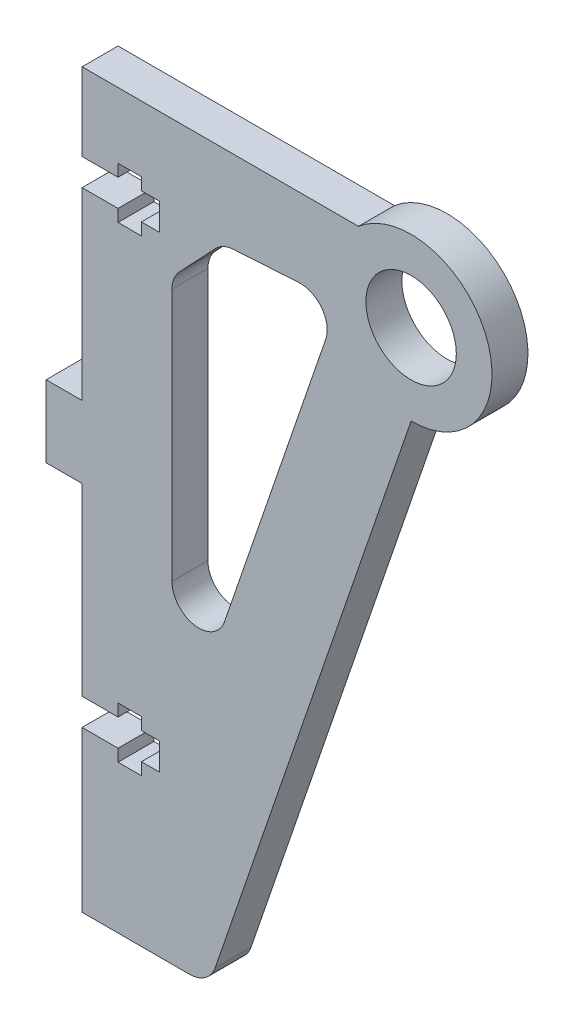
from build123d import *

# Parameters (mm, degrees)
SKETCH_1_R          = 5.03
EXTRUDE_1_DEPTH     = 4
CUT_EXTRUDE_1_DEPTH = 4
SKETCH_4_W          = 4
SKETCH_4_H          = 8
EXTRUDE_2_DEPTH     = 4


with BuildPart() as part:
    # 草图1 → 凸台-拉伸1 (new body)
    with BuildSketch(Plane.XY):
        with BuildLine():
            Line((-59.1, 38.97114317), (-59.1, 2.206540881))
            Line((-59.1, 2.206540881), (-59.1, -35.646026533))
            Line((-59.1, -35.646026533), (-47.142774211, -35.646026533))
            ThreePointArc((-47.142774211, -35.646026533), (-45.399104316, -35.087258865), (-44.304971996, -33.619103399))
            Line((-44.304971996, -33.619103399), (-22.5, 29.97114317))
            ThreePointArc((-22.5, 29.97114317), (-14.057833007, 42.090408542), (-28.351857593, 45.808961734))
            Line((-28.351857593, 45.808961734), (-56.281374572, 45.808961734))
            Line((-56.281374572, 45.808961734), (-59.1, 45.808961734))
            Line((-59.1, 45.808961734), (-59.1, 42.814449543))
            Line((-59.1, 42.814449543), (-59.1, 38.97114317))
        make_face()
        with BuildLine():
            ThreePointArc((-35.014022641, 37.07877749), (-34.09949662, 36.993301041), (-33.253696548, 36.635130268))
            ThreePointArc((-33.253696548, 36.635130268), (-32.007498532, 35.093487817), (-31.994845854, 33.111188432))
            Line((-31.994845854, 33.111188432), (-43.262197785, 0.251999821))
            ThreePointArc((-43.262197785, 0.251999821), (-46.59325113, -1.734096056), (-49.1, 1.225076687))
            Line((-49.1, 1.225076687), (-49.1, 15.527048957))
            Line((-49.1, 15.527048957), (-49.1, 29.38821049))
            ThreePointArc((-49.1, 29.38821049), (-48.888683815, 30.494213466), (-48.284504946, 31.444405555))
            Line((-48.284504946, 31.444405555), (-44.278244198, 35.700663421))
            ThreePointArc((-44.278244198, 35.700663421), (-43.366317827, 36.361183979), (-42.275113824, 36.638980548))
            Line((-42.275113824, 36.638980548), (-35.014022641, 37.07877749))
        make_face(mode=Mode.SUBTRACT)
        with Locations((-22.5, 38.97114317)):
            Circle(SKETCH_1_R, mode=Mode.SUBTRACT)
    extrude(amount=EXTRUDE_1_DEPTH)

    # 草图2 → 切除-拉伸1 (cut)
    with BuildSketch(Plane.XY.offset(4)):
        Polygon((-59.1, -14.837441681), (-55.1, -14.837441681), (-55.1, -13.487441681), (-52.5, -13.487441681), (-52.5, -14.837441681), (-50.5, -14.837441681), (-50.5, -17.837441681), (-52.5, -17.837441681), (-52.5, -19.187441681), (-55.1, -19.187441681), (-55.1, -17.837441681), (-59.1, -17.837441681), align=None)
        Polygon((-59.1, 37.162558319), (-55.1, 37.162558319), (-55.1, 38.512558319), (-52.5, 38.512558319), (-52.5, 37.162558319), (-50.5, 37.162558319), (-50.5, 34.162558319), (-52.5, 34.162558319), (-52.5, 32.812558319), (-55.1, 32.812558319), (-55.1, 34.162558319), (-59.1, 34.162558319), align=None)
    extrude(amount=-CUT_EXTRUDE_1_DEPTH, mode=Mode.SUBTRACT)

    # 草图4 → 凸台-拉伸2 (add)
    with BuildSketch(Plane.ZY.offset(59.1)):
        with Locations((2, 9.659412515)):
            Rectangle(SKETCH_4_W, SKETCH_4_H)
    extrude(amount=EXTRUDE_2_DEPTH)


solid = part.part
